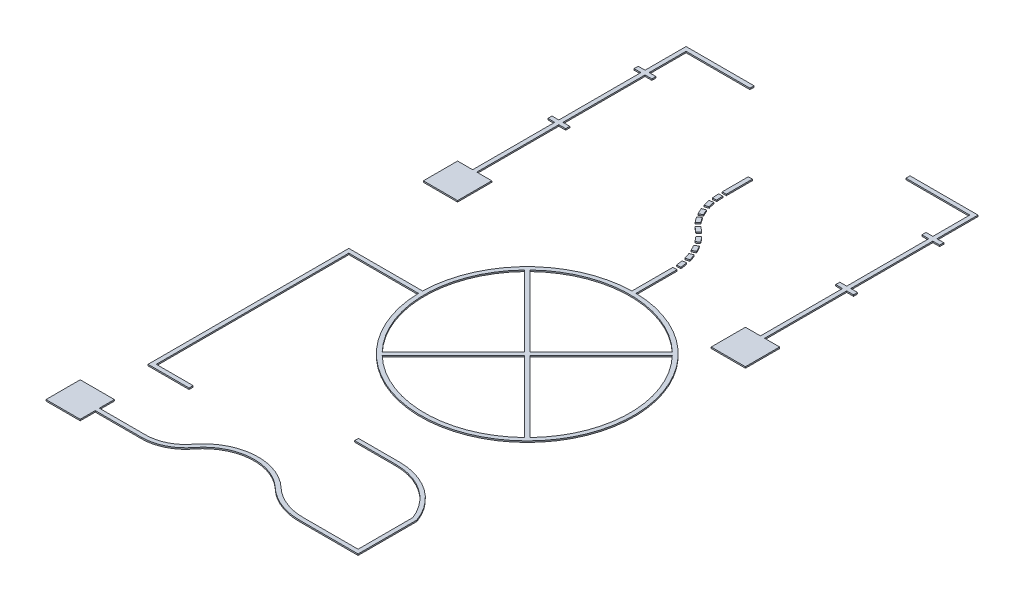
from build123d import *

# Parameters (mm, degrees)
SKETCH1_W           = 2438.4
SKETCH1_H           = 4876.8
BOSS_EXTRUDE1_DEPTH = 100
SKETCH2_W           = 29.994
SKETCH2_H           = 170.927857272
CUT_EXTRUDE1_DEPTH  = 100
SKETCH3_W           = 250
SKETCH3_H           = 9.999999353
BOSS_EXTRUDE2_DEPTH = 100
SKETCH4_W           = 29.994
SKETCH4_H           = 170.927857272
CUT_EXTRUDE2_DEPTH  = 90
SKETCH5_W           = 300
SKETCH5_H           = 30
BOSS_EXTRUDE4_DEPTH = 10
SKETCH7_W           = 300
SKETCH7_H           = 85.9
CUT_EXTRUDE4_DEPTH  = 10
SKETCH8_W           = 29.994
SKETCH8_H           = 10
BOSS_EXTRUDE5_DEPTH = 20
SKETCH9_W           = 30
SKETCH9_H           = 10
BOSS_EXTRUDE6_DEPTH = 20
SKETCH10_W          = 30
SKETCH10_H          = 10
BOSS_EXTRUDE7_DEPTH = 20


with BuildPart() as part:
    # Sketch1 → Boss-Extrude1 (new body)
    with BuildSketch(Plane(origin=(0, 0, 0), x_dir=(1, 0, 0), z_dir=(0, 1, 0))):
        Rectangle(SKETCH1_W, SKETCH1_H)
    extrude(amount=BOSS_EXTRUDE1_DEPTH)

    # Sketch2 → Cut-Extrude1 (cut)
    # profile 1 of 5: a face of its own
    with BuildSketch(Plane(origin=(0, 100, 0), x_dir=(1, 0, 0), z_dir=(0, 1, 0))):
        with BuildLine():
            Line((-919.2, -2198.399999353), (-919.2, -2308.399999353))
            Line((-919.2, -2308.399999353), (-581.571559488, -2308.399999353))
            ThreePointArc((-581.571559488, -2308.399999353), (-451.969437298, -2278.161401746), (-349.131269491, -2193.69013975))
            ThreePointArc((-349.131269491, -2193.69013975), (-61.32542962, -2037.352988639), (247.351631749, -2146.86087907))
            ThreePointArc((247.351631749, -2146.86087907), (372.597618285, -2227.162898782), (518.697268509, -2255.267412973))
            Line((518.697268509, -2255.267412973), (918.697268509, -2255.267412973))
            Line((918.697268509, -2255.267412973), (918.697268509, -1855.267412973))
            ThreePointArc((918.697268509, -1855.267412973), (761.332604312, -1655.820919441), (518.697268509, -1580.517299741))
            Line((518.697268509, -1580.517299741), (218.697268509, -1580.517299741))
            Line((218.697268509, -1580.517299741), (218.697268509, -1552.388885656))
            Line((218.697268509, -1552.388885656), (518.697268509, -1552.388885656))
            ThreePointArc((518.697268509, -1552.388885656), (781.677972321, -1635.709412665), (948.697268509, -1855.267412973))
            Line((948.697268509, -1855.267412973), (948.697268509, -2285.267412973))
            Line((948.697268509, -2285.267412973), (518.697268509, -2285.267412973))
            ThreePointArc((518.697268509, -2285.267412973), (361.467557357, -2255.021860423), (226.680169051, -2168.602328653))
            ThreePointArc((226.680169051, -2168.602328653), (-58.97738555, -2067.260958965), (-325.320184245, -2211.939310126))
            ThreePointArc((-325.320184245, -2211.939310126), (-438.693050577, -2305.063772564), (-581.571559488, -2338.399999353))
            Line((-581.571559488, -2338.399999353), (-919.2, -2338.399999353))
            Line((-919.2, -2338.399999353), (-919.2, -2438.4))
            Line((-919.2, -2438.4), (1219.2, -2438.4))
            Line((1219.2, -2438.4), (1219.2, 2438.4))
            Line((1219.2, 2438.4), (-1219.2, 2438.4))
            Line((-1219.2, 2438.4), (-1219.2, -2438.4))
            Line((-1219.2, -2438.4), (-1169.2, -2438.4))
            Line((-1169.2, -2438.4), (-1169.2, -2198.399999353))
            Line((-1169.2, -2198.399999353), (-919.2, -2198.399999353))
        make_face()
        with BuildLine():
            Line((-719.2, -1938.399999353), (-1019.2, -1938.399999353))
            Line((-1019.2, -1938.399999353), (-1019.2, -385))
            Line((-1019.2, -385), (-479.855755893, -385))
            ThreePointArc((-479.855755893, -385), (-251.543289326, 151.543289326), (285, 379.855755893))
            Line((285, 379.855755893), (285, 679.855755893))
            Line((285, 679.855755893), (315, 679.855755893))
            Line((315, 679.855755893), (315, 379.855755893))
            ThreePointArc((315, 379.855755893), (851.543289326, -951.543289326), (-479.855755893, -415))
            Line((-479.855755893, -415), (-989.2, -415))
            Line((-989.2, -415), (-989.2, -1908.399999353))
            Line((-989.2, -1908.399999353), (-719.2, -1908.399999353))
            Line((-719.2, -1908.399999353), (-719.2, -1938.399999353))
        make_face(mode=Mode.SUBTRACT)
        Polygon((-924.606, 315.4), (-1174.606, 315.4), (-1174.606, 565.4), (-1064.606, 565.4), (-1064.606, 1165.4), (-1114.606, 1165.4), (-1114.606, 1195.4), (-1064.606, 1195.4), (-1064.606, 1795.4), (-1114.606, 1795.4), (-1114.606, 1825.4), (-1064.606, 1825.4), (-1064.606, 2125.4), (-587.703, 2125.4), (-587.703, 2095.4), (-1034.606, 2095.4), (-1034.606, 1825.4), (-984.606, 1825.4), (-984.606, 1795.4), (-1034.606, 1795.4), (-1034.606, 1195.4), (-984.606, 1195.4), (-984.606, 1165.4), (-1034.606, 1165.4), (-1034.606, 565.4), (-924.606, 565.4), align=None, mode=Mode.SUBTRACT)
        with BuildLine():
            Line((313.363780337, 709.855755893), (283.48537458, 707.243266979))
            ThreePointArc((283.48537458, 707.243266979), (280.817354071, 730.454233152), (276.889903298, 753.485568645))
            Line((276.889903298, 753.485568645), (306.307291752, 759.330351401))
            ThreePointArc((306.307291752, 759.330351401), (310.509267678, 734.689146996), (313.363780337, 709.855755893))
        make_face(mode=Mode.SUBTRACT)
        with BuildLine():
            Line((299.292720231, 789.330351401), (270.333610539, 781.525596779))
            ThreePointArc((270.333610539, 781.525596779), (263.641859342, 803.91058617), (255.741601187, 825.898155504))
            Line((255.741601187, 825.898155504), (283.680743009, 836.804510677))
            ThreePointArc((283.680743009, 836.804510677), (292.133221855, 813.280030714), (299.292720231, 789.330351401))
        make_face(mode=Mode.SUBTRACT)
        with BuildLine():
            Line((270.72127371, 866.804510677), (243.628805062, 853.938183638))
            ThreePointArc((243.628805062, 853.938183638), (233.035185878, 874.762268653), (221.323804893, 894.978866774))
            Line((221.323804893, 894.978866774), (246.857174792, 910.713899361))
            ThreePointArc((246.857174792, 910.713899361), (259.387170406, 889.084179851), (270.72127371, 866.804510677))
        make_face(mode=Mode.SUBTRACT)
        with BuildLine():
            Line((165.011981963, 1009.40005714), (144.825754574, 987.217621459))
            ThreePointArc((144.825754574, 987.217621459), (127.124133149, 1002.466224119), (108.618763636, 1016.728712798))
            Line((108.618763636, 1016.728712798), (126.274156062, 1040.973946293))
            ThreePointArc((126.274156062, 1040.973946293), (146.073033678, 1025.714522931), (165.011981963, 1009.40005714))
        make_face(mode=Mode.SUBTRACT)
        with BuildLine():
            ThreePointArc((44.532414655, 1166.506238397), (53.763601741, 1145.241777983), (64.263689238, 1124.574406251))
            Line((64.263689238, 1124.574406251), (37.946077545, 1110.186100207))
            ThreePointArc((37.946077545, 1110.186100207), (26.624132388, 1132.471138247), (16.670406388, 1155.4))
            Line((16.670406388, 1155.4), (44.532414655, 1166.506238397))
        make_face(mode=Mode.SUBTRACT)
        with BuildLine():
            ThreePointArc((23.370750404, 1240.42684097), (28.170924763, 1217.747546054), (34.333657687, 1195.4))
            Line((34.333657687, 1195.4), (5.673377354, 1186.555319834))
            ThreePointArc((5.673377354, 1186.555319834), (-0.971721956, 1210.652041971), (-6.147613191, 1235.106479452))
            Line((-6.147613191, 1235.106479452), (23.370750404, 1240.42684097))
        make_face(mode=Mode.SUBTRACT)
        with BuildLine():
            ThreePointArc((77.22618432, 1102.631418758), (90.259847646, 1083.460719448), (104.428850873, 1065.113200834))
            Line((104.428850873, 1065.113200834), (81.255026867, 1046.0707767))
            ThreePointArc((81.255026867, 1046.0707767), (65.97699442, 1065.854383225), (51.923166638, 1086.525602039))
            Line((51.923166638, 1086.525602039), (77.22618432, 1102.631418758))
        make_face(mode=Mode.SUBTRACT)
        with BuildLine():
            Line((226.698240294, 940.713899361), (202.481901877, 923.018894908))
            ThreePointArc((202.481901877, 923.018894908), (188.18918005, 941.500923663), (172.911659512, 959.177593325))
            Line((172.911659512, 959.177593325), (195.061065513, 979.40005714))
            ThreePointArc((195.061065513, 979.40005714), (211.406470515, 960.487804723), (226.698240294, 940.713899361))
        make_face(mode=Mode.SUBTRACT)
        with BuildLine():
            Line((19.686621628, 1265.644853858), (-10.120104275, 1262.298344185))
            ThreePointArc((-10.120104275, 1262.298344185), (-12.156375106, 1287.211452455), (-12.682506858, 1312.202101665))
            Line((-12.682506858, 1312.202101665), (17.310223318, 1311.926107891))
            ThreePointArc((17.310223318, 1311.926107891), (17.798163275, 1288.749524745), (19.686621628, 1265.644853858))
        make_face(mode=Mode.SUBTRACT)
        with Locations((2.297, 1422.936071364)):
            Rectangle(SKETCH2_W, SKETCH2_H, mode=Mode.SUBTRACT)
        Polygon((592.297, 2125.4), (1069.2, 2125.4), (1069.2, 1825.4), (1119.2, 1825.4), (1119.2, 1795.4), (1069.2, 1795.4), (1069.2, 1195.4), (1119.2, 1195.4), (1119.2, 1165.4), (1069.2, 1165.4), (1069.2, 565.4), (1179.2, 565.4), (1179.2, 315.4), (929.2, 315.4), (929.2, 565.4), (1039.2, 565.4), (1039.2, 1165.4), (989.2, 1165.4), (989.2, 1195.4), (1039.2, 1195.4), (1039.2, 1795.4), (989.2, 1795.4), (989.2, 1825.4), (1039.2, 1825.4), (1039.2, 2095.4), (592.297, 2095.4), align=None, mode=Mode.SUBTRACT)
    # profile 2 of 5: a face of its own
    with BuildSketch(Plane(origin=(0, 100, 0), x_dir=(1, 0, 0), z_dir=(0, 1, 0))):
        with BuildLine():
            ThreePointArc((-219.617948483, -940.830091262), (300.00000001, -1150), (819.617948498, -940.830091248))
            Line((819.617948498, -940.830091248), (300, -421.21214275))
            Line((300, -421.21214275), (-219.617948483, -940.830091262))
        make_face()
    # profile 3 of 5: a face of its own
    with BuildSketch(Plane(origin=(0, 100, 0), x_dir=(1, 0, 0), z_dir=(0, 1, 0))):
        with BuildLine():
            Line((321.212142749, -399.999999999), (840.830091248, -919.617948498))
            ThreePointArc((840.830091248, -919.617948498), (1050, -399.999999989), (840.830091232, 119.617948514))
            Line((840.830091232, 119.617948514), (321.212142749, -399.999999999))
        make_face()
    # profile 4 of 5: a face of its own
    with BuildSketch(Plane(origin=(0, 100, 0), x_dir=(1, 0, 0), z_dir=(0, 1, 0))):
        with BuildLine():
            ThreePointArc((-240.830091247, 119.617948498), (-450, -399.99999999), (-240.830091262, -919.617948483))
            Line((-240.830091262, -919.617948483), (278.78785725, -400))
            Line((278.78785725, -400), (-240.830091247, 119.617948498))
        make_face()
    # profile 5 of 5: a face of its own
    with BuildSketch(Plane(origin=(0, 100, 0), x_dir=(1, 0, 0), z_dir=(0, 1, 0))):
        with BuildLine():
            Line((-219.617948498, 140.830091247), (300.000000001, -378.787857251))
            Line((300.000000001, -378.787857251), (819.617948513, 140.830091233))
            ThreePointArc((819.617948513, 140.830091233), (300.00000001, 350), (-219.617948498, 140.830091247))
        make_face()
    extrude(amount=-CUT_EXTRUDE1_DEPTH, mode=Mode.SUBTRACT)


with BuildPart() as cut_extrude1_piece_1:
    # of the separate pieces the step leaves, piece 1, a body of its own (cut_extrude1_pieces)
    add(part.part.solids().sort_by_distance((-479.855755893, 0, 415))[0])


with BuildPart() as cut_extrude1_piece_2:
    # of the separate pieces the step leaves, piece 2, a body of its own (cut_extrude1_pieces)
    add(part.part.solids().sort_by_distance((-919.2, 0, 2438.4))[0])

    # Sketch3 → Boss-Extrude2 (add)
    with BuildSketch(Plane(origin=(0, 100, 0), x_dir=(1, 0, 0), z_dir=(0, 1, 0))):
        with Locations((-1044.2, -2443.399999677)):
            Rectangle(SKETCH3_W, SKETCH3_H)
    extrude(amount=-BOSS_EXTRUDE2_DEPTH)


with BuildPart() as cut_extrude1_piece_3:
    # of the separate pieces the step leaves, piece 3, a body of its own (cut_extrude1_pieces)
    add(part.part.solids().sort_by_distance((592.297, 0, -2095.4))[0])


with BuildPart() as cut_extrude1_piece_4:
    # of the separate pieces the step leaves, piece 4, a body of its own (cut_extrude1_pieces)
    add(part.part.solids().sort_by_distance((-924.606, 0, -565.4))[0])


with BuildPart() as cut_extrude1_piece_5:
    # of the separate pieces the step leaves, piece 5, a body of its own (cut_extrude1_pieces)
    add(part.part.solids().sort_by_distance((-12.7, 0, -1508.4))[0])


with BuildPart() as cut_extrude1_piece_6:
    # of the separate pieces the step leaves, piece 6, a body of its own (cut_extrude1_pieces)
    add(part.part.solids().sort_by_distance((172.911659512, 0, -959.177593325))[0])


with BuildPart() as cut_extrude1_piece_7:
    # of the separate pieces the step leaves, piece 7, a body of its own (cut_extrude1_pieces)
    add(part.part.solids().sort_by_distance((243.628805062, 0, -853.938183638))[0])


with BuildPart() as cut_extrude1_piece_8:
    # of the separate pieces the step leaves, piece 8, a body of its own (cut_extrude1_pieces)
    add(part.part.solids().sort_by_distance((144.825754574, 0, -987.217621459))[0])


with BuildPart() as cut_extrude1_piece_9:
    # of the separate pieces the step leaves, piece 9, a body of its own (cut_extrude1_pieces)
    add(part.part.solids().sort_by_distance((270.333610539, 0, -781.525596779))[0])


with BuildPart() as cut_extrude1_piece_10:
    # of the separate pieces the step leaves, piece 10, a body of its own (cut_extrude1_pieces)
    add(part.part.solids().sort_by_distance((306.307291752, 0, -759.330351401))[0])


with BuildPart() as cut_extrude1_piece_11:
    # of the separate pieces the step leaves, piece 11, a body of its own (cut_extrude1_pieces)
    add(part.part.solids().sort_by_distance((16.670406388, 0, -1155.4))[0])


with BuildPart() as cut_extrude1_piece_12:
    # of the separate pieces the step leaves, piece 12, a body of its own (cut_extrude1_pieces)
    add(part.part.solids().sort_by_distance((23.370750404, 0, -1240.42684097))[0])


with BuildPart() as cut_extrude1_piece_13:
    # of the separate pieces the step leaves, piece 13, a body of its own (cut_extrude1_pieces)
    add(part.part.solids().sort_by_distance((-10.120104275, 0, -1262.298344185))[0])


with BuildPart() as cut_extrude1_piece_14:
    # of the separate pieces the step leaves, piece 14, a body of its own (cut_extrude1_pieces)
    add(part.part.solids().sort_by_distance((104.428850873, 0, -1065.113200834))[0])


with BuildPart() as cut_extrude2_tool:
    # Sketch4 → Cut-Extrude2 (new body)
    with BuildSketch(Plane.XZ):
        with BuildLine():
            Line((313.363780337, -709.855755893), (283.48537458, -707.243266979))
            ThreePointArc((283.48537458, -707.243266979), (280.817354071, -730.454233152), (276.889903298, -753.485568645))
            Line((276.889903298, -753.485568645), (306.307291752, -759.330351401))
            ThreePointArc((306.307291752, -759.330351401), (310.509267678, -734.689146996), (313.363780337, -709.855755893))
        make_face()
        with BuildLine():
            Line((299.292720231, -789.330351401), (270.333610539, -781.525596779))
            ThreePointArc((270.333610539, -781.525596779), (263.641859342, -803.91058617), (255.741601187, -825.898155504))
            Line((255.741601187, -825.898155504), (283.680743009, -836.804510677))
            ThreePointArc((283.680743009, -836.804510677), (292.133221855, -813.280030714), (299.292720231, -789.330351401))
        make_face()
        with BuildLine():
            Line((-919.2, 2338.399999353), (-919.2, 2448.399999353))
            Line((-919.2, 2448.399999353), (-1169.2, 2448.399999353))
            Line((-1169.2, 2448.399999353), (-1169.2, 2198.399999353))
            Line((-1169.2, 2198.399999353), (-919.2, 2198.399999353))
            Line((-919.2, 2198.399999353), (-919.2, 2308.399999353))
            Line((-919.2, 2308.399999353), (-581.571559488, 2308.399999353))
            ThreePointArc((-581.571559488, 2308.399999353), (-451.969437298, 2278.161401746), (-349.131269491, 2193.69013975))
            ThreePointArc((-349.131269491, 2193.69013975), (-61.32542962, 2037.352988639), (247.351631749, 2146.86087907))
            ThreePointArc((247.351631749, 2146.86087907), (372.597618285, 2227.162898782), (518.697268509, 2255.267412973))
            Line((518.697268509, 2255.267412973), (918.697268509, 2255.267412973))
            Line((918.697268509, 2255.267412973), (918.697268509, 1855.267412973))
            ThreePointArc((918.697268509, 1855.267412973), (761.332604312, 1655.820919441), (518.697268509, 1580.517299741))
            Line((518.697268509, 1580.517299741), (218.697268509, 1580.517299741))
            Line((218.697268509, 1580.517299741), (218.697268509, 1552.388885656))
            Line((218.697268509, 1552.388885656), (518.697268509, 1552.388885656))
            ThreePointArc((518.697268509, 1552.388885656), (781.677972321, 1635.709412665), (948.697268509, 1855.267412973))
            Line((948.697268509, 1855.267412973), (948.697268509, 2285.267412973))
            Line((948.697268509, 2285.267412973), (518.697268509, 2285.267412973))
            ThreePointArc((518.697268509, 2285.267412973), (361.467557357, 2255.021860423), (226.680169051, 2168.602328653))
            ThreePointArc((226.680169051, 2168.602328653), (-58.97738555, 2067.260958965), (-325.320184245, 2211.939310126))
            ThreePointArc((-325.320184245, 2211.939310126), (-438.693050577, 2305.063772564), (-581.571559488, 2338.399999353))
            Line((-581.571559488, 2338.399999353), (-919.2, 2338.399999353))
        make_face()
        with BuildLine():
            Line((285, -379.855755893), (285, -679.855755893))
            Line((285, -679.855755893), (315, -679.855755893))
            Line((315, -679.855755893), (315, -379.855755893))
            ThreePointArc((315, -379.855755893), (851.543289326, 951.543289326), (-479.855755893, 415))
            Line((-479.855755893, 415), (-989.2, 415))
            Line((-989.2, 415), (-989.2, 1908.399999353))
            Line((-989.2, 1908.399999353), (-719.2, 1908.399999353))
            Line((-719.2, 1908.399999353), (-719.2, 1938.399999353))
            Line((-719.2, 1938.399999353), (-1019.2, 1938.399999353))
            Line((-1019.2, 1938.399999353), (-1019.2, 385))
            Line((-1019.2, 385), (-479.855755893, 385))
            ThreePointArc((-479.855755893, 385), (-251.543289326, -151.543289326), (285, -379.855755893))
        make_face()
        with BuildLine():
            Line((270.72127371, -866.804510677), (243.628805062, -853.938183638))
            ThreePointArc((243.628805062, -853.938183638), (233.035185878, -874.762268653), (221.323804893, -894.978866774))
            Line((221.323804893, -894.978866774), (246.857174792, -910.713899361))
            ThreePointArc((246.857174792, -910.713899361), (259.387170406, -889.084179851), (270.72127371, -866.804510677))
        make_face()
        with BuildLine():
            Line((226.698240294, -940.713899361), (202.481901877, -923.018894908))
            ThreePointArc((202.481901877, -923.018894908), (188.18918005, -941.500923663), (172.911659512, -959.177593325))
            Line((172.911659512, -959.177593325), (195.061065513, -979.40005714))
            ThreePointArc((195.061065513, -979.40005714), (211.406470515, -960.487804723), (226.698240294, -940.713899361))
        make_face()
        with BuildLine():
            Line((165.011981963, -1009.40005714), (144.825754574, -987.217621459))
            ThreePointArc((144.825754574, -987.217621459), (127.124133149, -1002.466224119), (108.618763636, -1016.728712798))
            Line((108.618763636, -1016.728712798), (126.274156062, -1040.973946293))
            ThreePointArc((126.274156062, -1040.973946293), (146.073033678, -1025.714522931), (165.011981963, -1009.40005714))
        make_face()
        with BuildLine():
            Line((51.923166638, -1086.525602039), (77.22618432, -1102.631418758))
            ThreePointArc((77.22618432, -1102.631418758), (90.259847646, -1083.460719448), (104.428850873, -1065.113200834))
            Line((104.428850873, -1065.113200834), (81.255026867, -1046.0707767))
            ThreePointArc((81.255026867, -1046.0707767), (65.97699442, -1065.854383225), (51.923166638, -1086.525602039))
        make_face()
        with BuildLine():
            Line((16.670406388, -1155.4), (44.532414655, -1166.506238397))
            ThreePointArc((44.532414655, -1166.506238397), (53.763601741, -1145.241777983), (64.263689238, -1124.574406251))
            Line((64.263689238, -1124.574406251), (37.946077545, -1110.186100207))
            ThreePointArc((37.946077545, -1110.186100207), (26.624132388, -1132.471138247), (16.670406388, -1155.4))
        make_face()
        with BuildLine():
            Line((-6.147613191, -1235.106479452), (23.370750404, -1240.42684097))
            ThreePointArc((23.370750404, -1240.42684097), (28.170924763, -1217.747546054), (34.333657687, -1195.4))
            Line((34.333657687, -1195.4), (5.673377354, -1186.555319834))
            ThreePointArc((5.673377354, -1186.555319834), (-0.971721956, -1210.652041971), (-6.147613191, -1235.106479452))
        make_face()
        with BuildLine():
            Line((-12.682506858, -1312.202101665), (17.310223318, -1311.926107891))
            ThreePointArc((17.310223318, -1311.926107891), (17.798163275, -1288.749524745), (19.686621628, -1265.644853858))
            Line((19.686621628, -1265.644853858), (-10.120104275, -1262.298344185))
            ThreePointArc((-10.120104275, -1262.298344185), (-12.156375106, -1287.211452455), (-12.682506858, -1312.202101665))
        make_face()
        with Locations((2.297, -1422.936071364)):
            Rectangle(SKETCH4_W, SKETCH4_H)
        Polygon((-1064.606, -1825.4), (-1064.606, -2125.4), (-587.703, -2125.4), (-587.703, -2095.4), (-1034.606, -2095.4), (-1034.606, -1825.4), (-984.606, -1825.4), (-984.606, -1795.4), (-1034.606, -1795.4), (-1034.606, -1195.4), (-984.606, -1195.4), (-984.606, -1165.4), (-1034.606, -1165.4), (-1034.606, -565.4), (-924.606, -565.4), (-924.606, -315.4), (-1174.606, -315.4), (-1174.606, -565.4), (-1064.606, -565.4), (-1064.606, -1165.4), (-1114.606, -1165.4), (-1114.606, -1195.4), (-1064.606, -1195.4), (-1064.606, -1795.4), (-1114.606, -1795.4), (-1114.606, -1825.4), align=None)
        Polygon((1039.2, -2095.4), (592.297, -2095.4), (592.297, -2125.4), (1069.2, -2125.4), (1069.2, -1825.4), (1119.2, -1825.4), (1119.2, -1795.4), (1069.2, -1795.4), (1069.2, -1195.4), (1119.2, -1195.4), (1119.2, -1165.4), (1069.2, -1165.4), (1069.2, -565.4), (1179.2, -565.4), (1179.2, -315.4), (929.2, -315.4), (929.2, -565.4), (1039.2, -565.4), (1039.2, -1165.4), (989.2, -1165.4), (989.2, -1195.4), (1039.2, -1195.4), (1039.2, -1795.4), (989.2, -1795.4), (989.2, -1825.4), (1039.2, -1825.4), align=None)
    extrude(amount=-CUT_EXTRUDE2_DEPTH)


with BuildPart() as cut_extrude1_piece_1_1:
    add(cut_extrude1_piece_1.part)

    # Cut-Extrude2: cut by cut_extrude2_tool
    add(cut_extrude2_tool.part, mode=Mode.SUBTRACT)

    # Sketch5 → Boss-Extrude4 (add)
    with BuildSketch(Plane(origin=(0, 100, 0), x_dir=(1, 0, 0), z_dir=(0, 1, 0))):
        with Locations((-869.2, -1837.499999353)):
            Rectangle(SKETCH5_W, SKETCH5_H)
    extrude(amount=-BOSS_EXTRUDE4_DEPTH)

    # Sketch7 → Cut-Extrude4 (cut)
    with BuildSketch(Plane(origin=(0, 100, 0), x_dir=(1, 0, 0), z_dir=(0, 1, 0))):
        with Locations((-869.2, -1895.449999353)):
            Rectangle(SKETCH7_W, SKETCH7_H)
    extrude(amount=-CUT_EXTRUDE4_DEPTH, mode=Mode.SUBTRACT)


with BuildPart() as cut_extrude1_piece_2_1:
    add(cut_extrude1_piece_2.part)

    # Cut-Extrude2: cut by cut_extrude2_tool
    add(cut_extrude2_tool.part, mode=Mode.SUBTRACT)


with BuildPart() as cut_extrude1_piece_3_1:
    add(cut_extrude1_piece_3.part)

    # Cut-Extrude2: cut by cut_extrude2_tool
    add(cut_extrude2_tool.part, mode=Mode.SUBTRACT)

    # Sketch9 → Boss-Extrude6 (add)
    with BuildSketch(Plane.ZY.offset(-592.297)):
        with Locations((-2110.4, 95)):
            Rectangle(SKETCH9_W, SKETCH9_H)
    extrude(amount=BOSS_EXTRUDE6_DEPTH)


with BuildPart() as cut_extrude1_piece_4_1:
    add(cut_extrude1_piece_4.part)

    # Cut-Extrude2: cut by cut_extrude2_tool
    add(cut_extrude2_tool.part, mode=Mode.SUBTRACT)

    # Sketch10 → Boss-Extrude7 (add)
    with BuildSketch(Plane(origin=(-587.703, 0, 0), x_dir=(0, 0, -1), z_dir=(1, 0, 0))):
        with Locations((2110.4, 95)):
            Rectangle(SKETCH10_W, SKETCH10_H)
    extrude(amount=BOSS_EXTRUDE7_DEPTH)


with BuildPart() as cut_extrude1_piece_5_1:
    add(cut_extrude1_piece_5.part)

    # Cut-Extrude2: cut by cut_extrude2_tool
    add(cut_extrude2_tool.part, mode=Mode.SUBTRACT)

    # Sketch8 → Boss-Extrude5 (add)
    with BuildSketch(Plane(origin=(0, 0, -1508.4), x_dir=(-1, 0, 0), z_dir=(0, 0, -1))):
        with Locations((-2.297, 95)):
            Rectangle(SKETCH8_W, SKETCH8_H)
    extrude(amount=BOSS_EXTRUDE5_DEPTH)


with BuildPart() as cut_extrude1_piece_6_1:
    add(cut_extrude1_piece_6.part)

    # Cut-Extrude2: cut by cut_extrude2_tool
    add(cut_extrude2_tool.part, mode=Mode.SUBTRACT)


with BuildPart() as cut_extrude1_piece_7_1:
    add(cut_extrude1_piece_7.part)

    # Cut-Extrude2: cut by cut_extrude2_tool
    add(cut_extrude2_tool.part, mode=Mode.SUBTRACT)


with BuildPart() as cut_extrude1_piece_8_1:
    add(cut_extrude1_piece_8.part)

    # Cut-Extrude2: cut by cut_extrude2_tool
    add(cut_extrude2_tool.part, mode=Mode.SUBTRACT)


with BuildPart() as cut_extrude1_piece_9_1:
    add(cut_extrude1_piece_9.part)

    # Cut-Extrude2: cut by cut_extrude2_tool
    add(cut_extrude2_tool.part, mode=Mode.SUBTRACT)


with BuildPart() as cut_extrude1_piece_10_1:
    add(cut_extrude1_piece_10.part)

    # Cut-Extrude2: cut by cut_extrude2_tool
    add(cut_extrude2_tool.part, mode=Mode.SUBTRACT)


with BuildPart() as cut_extrude1_piece_11_1:
    add(cut_extrude1_piece_11.part)

    # Cut-Extrude2: cut by cut_extrude2_tool
    add(cut_extrude2_tool.part, mode=Mode.SUBTRACT)


with BuildPart() as cut_extrude1_piece_12_1:
    add(cut_extrude1_piece_12.part)

    # Cut-Extrude2: cut by cut_extrude2_tool
    add(cut_extrude2_tool.part, mode=Mode.SUBTRACT)


with BuildPart() as cut_extrude1_piece_13_1:
    add(cut_extrude1_piece_13.part)

    # Cut-Extrude2: cut by cut_extrude2_tool
    add(cut_extrude2_tool.part, mode=Mode.SUBTRACT)


with BuildPart() as cut_extrude1_piece_14_1:
    add(cut_extrude1_piece_14.part)

    # Cut-Extrude2: cut by cut_extrude2_tool
    add(cut_extrude2_tool.part, mode=Mode.SUBTRACT)


solid = Compound([cut_extrude1_piece_1_1.part, cut_extrude1_piece_2_1.part, cut_extrude1_piece_3_1.part, cut_extrude1_piece_4_1.part, cut_extrude1_piece_5_1.part, cut_extrude1_piece_6_1.part, cut_extrude1_piece_7_1.part, cut_extrude1_piece_8_1.part, cut_extrude1_piece_9_1.part, cut_extrude1_piece_10_1.part, cut_extrude1_piece_11_1.part, cut_extrude1_piece_12_1.part, cut_extrude1_piece_13_1.part, cut_extrude1_piece_14_1.part])
